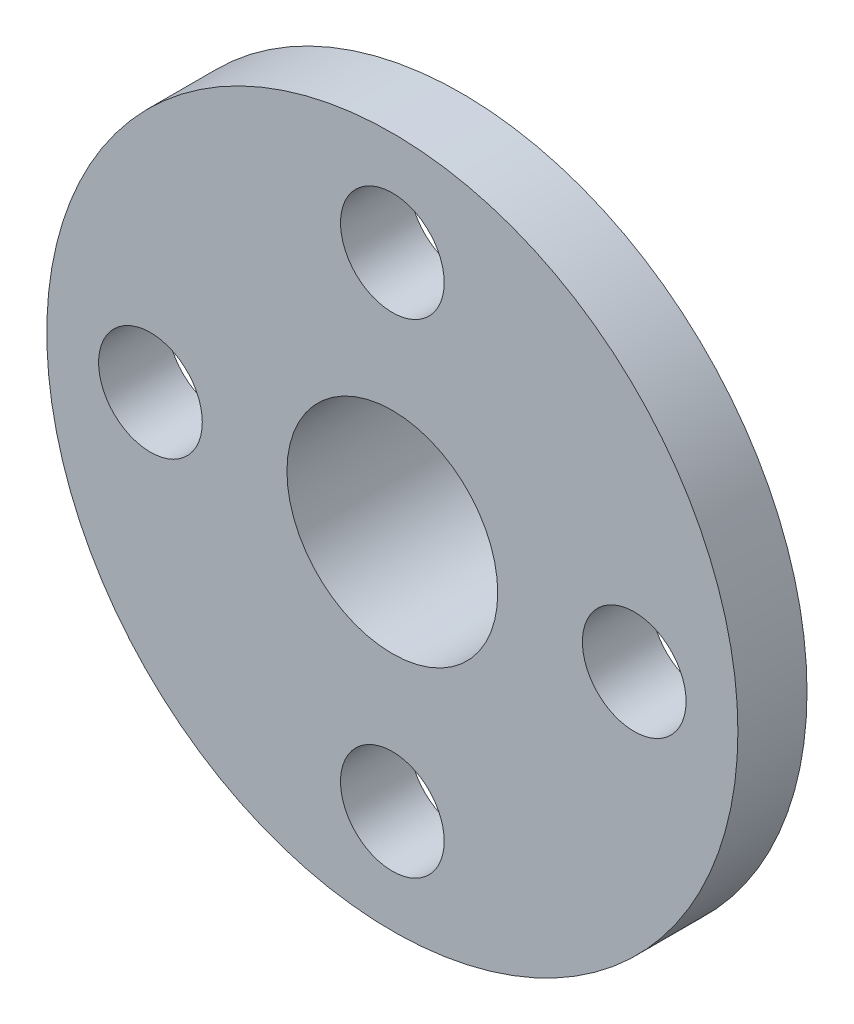
from build123d import *

# Parameters (mm, degrees)
METAL_DISC_OD20_THICKNESS2_PROFILE_R       = 10
METAL_DISC_OD20_THICKNESS2_PROFILE_R_2     = 3.05
METAL_DISC_OD20_THICKNESS2_DEPTH           = 2
PURCHASED_25T_HUB_ENVELOPE_OD9_START       = -2.5
PURCHASED_25T_HUB_ENVELOPE_OD9_PROFILE_R   = 4.5
PURCHASED_25T_HUB_ENVELOPE_OD9_PROFILE_R_2 = 3.05
PURCHASED_25T_HUB_ENVELOPE_OD9_DEPTH       = 2.5
FOUR_M3_TAPPED_HOLE_ENVELOPES_PCD14_START  = -50
FOUR_M3_TAPPED_HOLE_ENVELOPES_PCD14_PROF_R = 1.5
FOUR_M3_TAPPED_HOLE_ENVELOPES_PCD14_DEPTH  = 65.361406616


with BuildPart() as part:
    # Metal_disc_OD20_thickness2_profile → Metal_disc_OD20_thickness2 (new body)
    with BuildSketch(Plane.XY):
        Circle(METAL_DISC_OD20_THICKNESS2_PROFILE_R)
        Circle(METAL_DISC_OD20_THICKNESS2_PROFILE_R_2, mode=Mode.SUBTRACT)
    extrude(amount=METAL_DISC_OD20_THICKNESS2_DEPTH)

    # Purchased_25T_hub_envelope_OD9_profile → Purchased_25T_hub_envelope_OD9 (add)
    with BuildSketch(Plane.XY.offset(PURCHASED_25T_HUB_ENVELOPE_OD9_START)):
        Circle(PURCHASED_25T_HUB_ENVELOPE_OD9_PROFILE_R)
        Circle(PURCHASED_25T_HUB_ENVELOPE_OD9_PROFILE_R_2, mode=Mode.SUBTRACT)
    extrude(amount=PURCHASED_25T_HUB_ENVELOPE_OD9_DEPTH)

    # Four_M3_tapped_hole_envelopes_PCD14_profile → Four_M3_tapped_hole_envelopes_PCD14 (cut, through all)
    with BuildSketch(Plane.XY.offset(FOUR_M3_TAPPED_HOLE_ENVELOPES_PCD14_START)):
        with Locations((-7, 0)):
            Circle(FOUR_M3_TAPPED_HOLE_ENVELOPES_PCD14_PROF_R)
        with Locations((7, 0)):
            Circle(FOUR_M3_TAPPED_HOLE_ENVELOPES_PCD14_PROF_R)
        with Locations((0, -7)):
            Circle(FOUR_M3_TAPPED_HOLE_ENVELOPES_PCD14_PROF_R)
        with Locations((0, 7)):
            Circle(FOUR_M3_TAPPED_HOLE_ENVELOPES_PCD14_PROF_R)
    extrude(amount=FOUR_M3_TAPPED_HOLE_ENVELOPES_PCD14_DEPTH, mode=Mode.SUBTRACT)


solid = part.part
